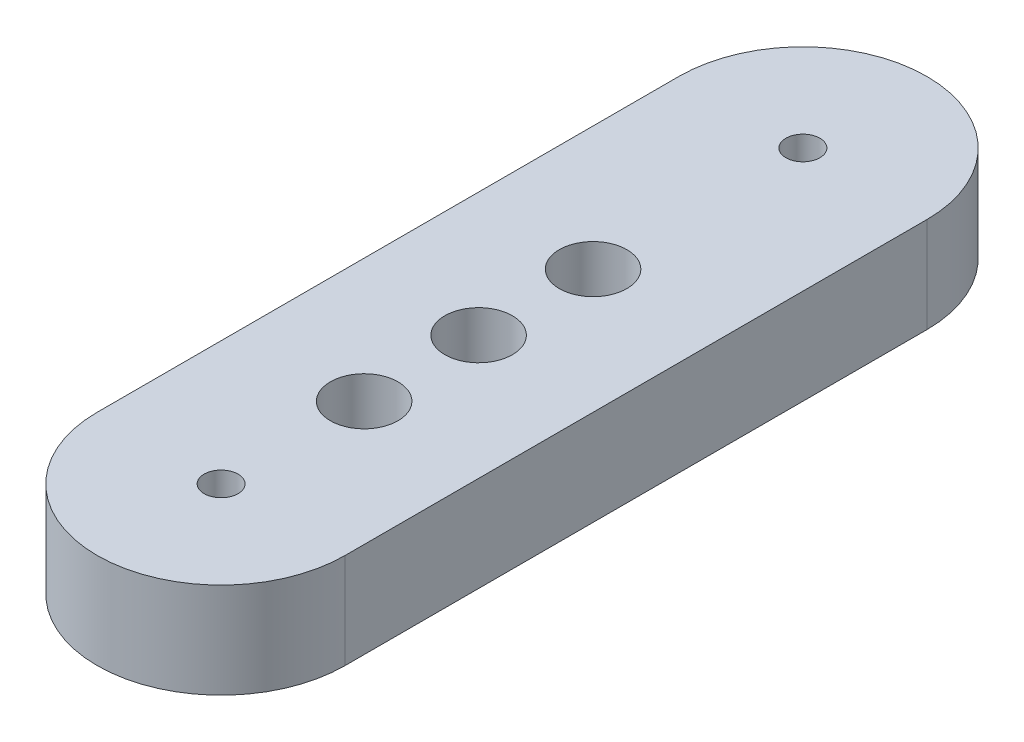
from build123d import *

# Parameters (mm, degrees)
SKETCH1_R           = 1.1303
SKETCH1_R_2         = 2.25
BOSS_EXTRUDE1_DEPTH = 6.35


with BuildPart() as part:
    # Sketch1 → Boss-Extrude1 (new body)
    with BuildSketch(Plane(origin=(0, 0, 0), x_dir=(1, 0, 0), z_dir=(0, 1, 0))):
        with BuildLine():
            Line((-8.255, -19.3675), (-8.255, 19.3675))
            ThreePointArc((-8.255, 19.3675), (0, 27.6225), (8.255, 19.3675))
            Line((8.255, 19.3675), (8.255, -19.3675))
            ThreePointArc((8.255, -19.3675), (0, -27.6225), (-8.255, -19.3675))
        make_face()
        with Locations(Location((0, 19.3675, 0), (0, 0, 270))):
            Circle(SKETCH1_R, mode=Mode.SUBTRACT)
        with Locations(Location((0, -19.3675, 0), (0, 0, 270))):
            Circle(SKETCH1_R, mode=Mode.SUBTRACT)
        with Locations(Location((0, -9.8425, 0), (0, 0, 270))):
            Circle(SKETCH1_R_2, mode=Mode.SUBTRACT)
        with Locations(Location((0, -2.2225, 0), (0, 0, 270))):
            Circle(SKETCH1_R_2, mode=Mode.SUBTRACT)
        with Locations(Location((0, 5.3975, 0), (0, 0, 270))):
            Circle(SKETCH1_R_2, mode=Mode.SUBTRACT)
    extrude(amount=BOSS_EXTRUDE1_DEPTH)


solid = part.part
